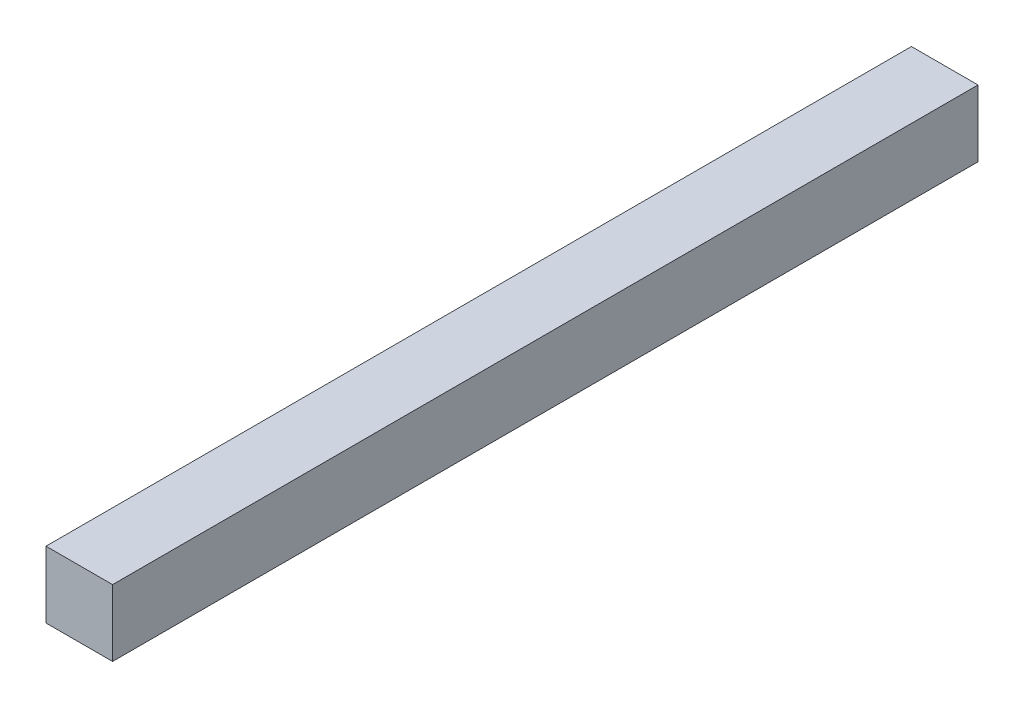
from build123d import *

# Parameters (mm, degrees)
SKETCH1_W           = 2.54
SKETCH1_H           = 2.54
BOSS_EXTRUDE1_DEPTH = 33.02


with BuildPart() as part:
    # Sketch1 → Boss-Extrude1 (new body)
    with BuildSketch(Plane.XY):
        with Locations((-1.27, 1.27)):
            Rectangle(SKETCH1_W, SKETCH1_H)
    extrude(amount=BOSS_EXTRUDE1_DEPTH)


solid = part.part
